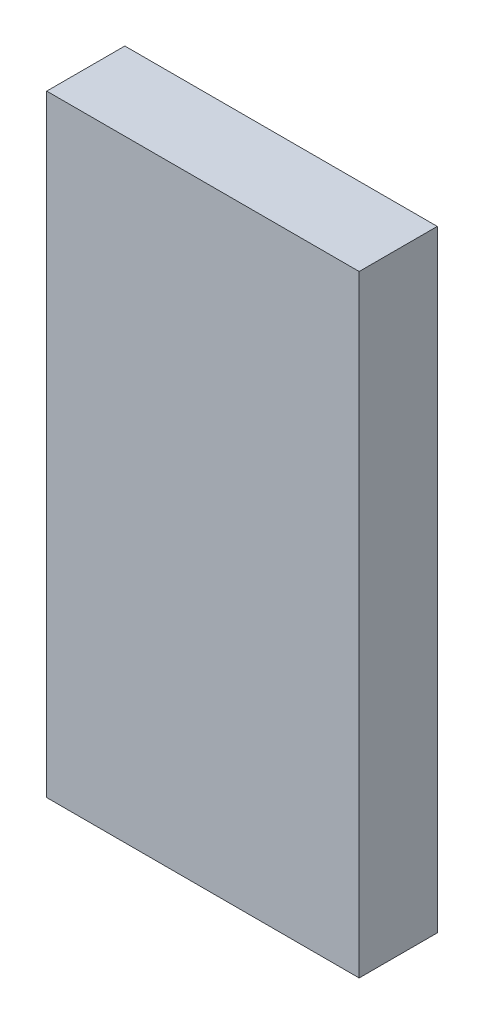
from build123d import *

# Parameters (mm, degrees)
ESBO_O1_W                = 12
ESBO_O1_H                = 23.5
RESSALTO_EXTRUS_O1_DEPTH = 3


with BuildPart() as part:
    # Esboço1 → Ressalto-extrusão1 (new body)
    with BuildSketch(Plane.XY):
        with Locations((-9.277777778, 2.709325397)):
            Rectangle(ESBO_O1_W, ESBO_O1_H)
    extrude(amount=RESSALTO_EXTRUS_O1_DEPTH)


solid = part.part
